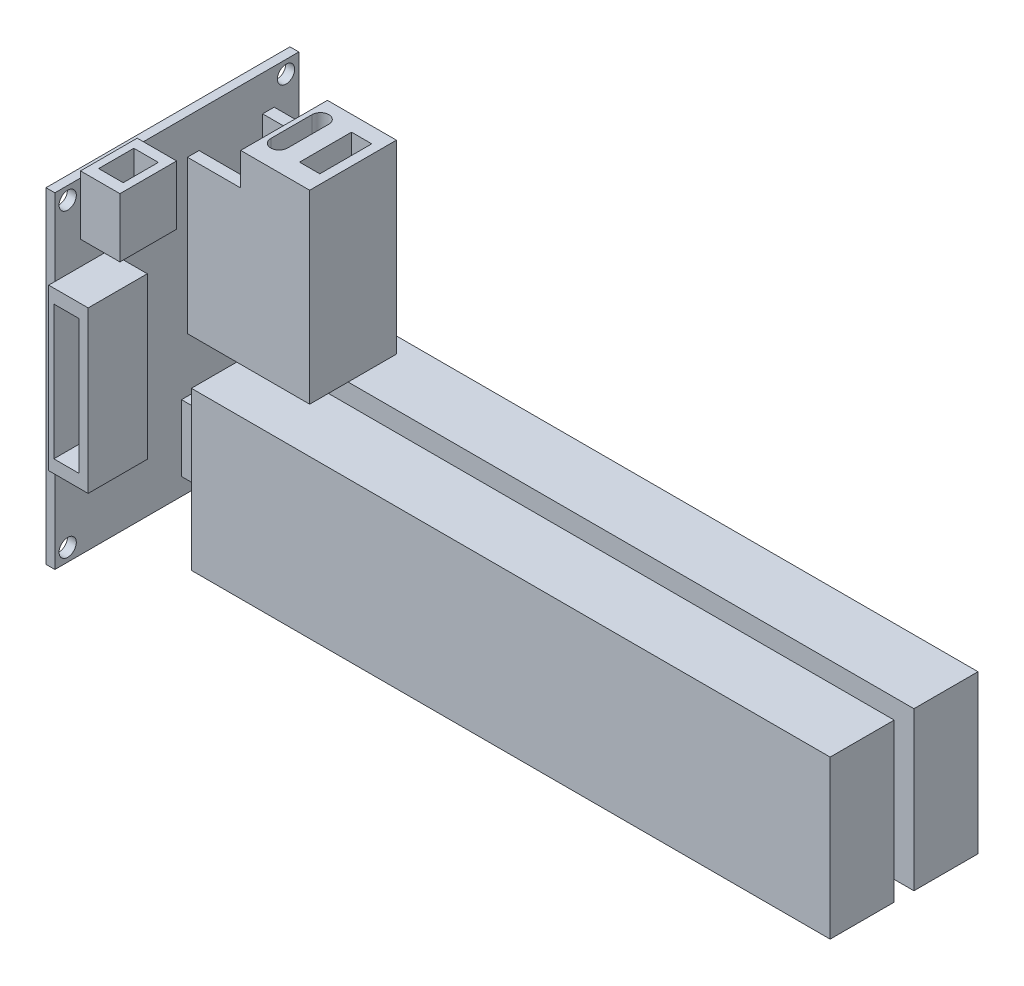
from build123d import *

# Parameters (mm, degrees)
SKETCH2_W               = 129.6
SKETCH2_H               = 32
BOSS_EXTRUDE1_DEPTH     = 30
SKETCH3_W               = 2.4
SKETCH3_H               = 13.5
BOSS_EXTRUDE2_DEPTH     = 8
SKETCH4_W               = 49.5
SKETCH4_H               = 66.2
BOSS_EXTRUDE3_DEPTH     = 1.8
SKETCH5_R               = 1.75
CUT_EXTRUDE1_DEPTH      = 1.8
SKETCH6_W               = 2.35
SKETCH6_H               = 31
BOSS_EXTRUDE4_DEPTH     = 10.8
SKETCH7_W               = 17.6
SKETCH7_H               = 37.6
BOSS_EXTRUDE5_DEPTH     = 14
SKETCH8_W               = 11.5
SKETCH8_H               = 12
SKETCH8_W_2             = 12
SKETCH8_H_2             = 32.6
BOSS_EXTRUDE6_DEPTH     = 8
CUT_EXTRUDE2_DEPTH      = 8
CUT_EXTRUDE2_DEPTH_BACK = 8
SKETCH9_W               = 4.972856148
SKETCH9_H               = 7.139248924
SKETCH9_W_2             = 4.11169422
SKETCH9_H_2             = 10.539835888
SKETCH10_W              = 5.114878679
SKETCH10_H              = 27.206324026
CUT_EXTRUDE3_DEPTH      = 8
CUT_EXTRUDE4_DEPTH      = 166.599411231
CUT_EXTRUDE4_DEPTH_BACK = 129.6
SKETCH11_W              = 4
SKETCH11_H              = 32


with BuildPart() as part:
    # Sketch2 → Boss-Extrude1 (new body)
    with BuildSketch(Plane.XY):
        with Locations((64.8, 16)):
            Rectangle(SKETCH2_W, SKETCH2_H)
    extrude(amount=BOSS_EXTRUDE1_DEPTH)

    # Sketch3 → Boss-Extrude2 (add)
    with BuildSketch(Plane.ZY):
        with Locations((7.2, 16.25)):
            Rectangle(SKETCH3_W, SKETCH3_H)
        with Locations((22.8, 16.25)):
            Rectangle(SKETCH3_W, SKETCH3_H)
    extrude(amount=BOSS_EXTRUDE2_DEPTH)

    # Sketch4 → Boss-Extrude3 (add)
    with BuildSketch(Plane.ZY.offset(8)):
        with Locations((24.95, 39.1)):
            Rectangle(SKETCH4_W, SKETCH4_H)
    extrude(amount=BOSS_EXTRUDE3_DEPTH)

    # Sketch5 → Cut-Extrude1 (cut)
    with BuildSketch(Plane.ZY.offset(9.8)):
        with Locations((2.8, 69.6)):
            Circle(SKETCH5_R)
        with Locations((47.1, 69.6)):
            Circle(SKETCH5_R)
        with Locations((47.1, 8.6)):
            Circle(SKETCH5_R)
        with Locations((2.8, 8.6)):
            Circle(SKETCH5_R)
    extrude(amount=-CUT_EXTRUDE1_DEPTH, mode=Mode.SUBTRACT)

    # Sketch6 → Boss-Extrude4 (add)
    with BuildSketch(Plane(origin=(-8, 0, 0), x_dir=(0, 0, -1), z_dir=(1, 0, 0))):
        with Locations((-6.375, 49.5)):
            Rectangle(SKETCH6_W, SKETCH6_H)
        with Locations((-21.625, 49.5)):
            Rectangle(SKETCH6_W, SKETCH6_H)
    extrude(amount=BOSS_EXTRUDE4_DEPTH)

    # Sketch7 → Boss-Extrude5 (add)
    with BuildSketch(Plane(origin=(2.8, 0, 0), x_dir=(0, 0, -1), z_dir=(1, 0, 0))):
        with Locations((-14, 52.8)):
            Rectangle(SKETCH7_W, SKETCH7_H)
    extrude(amount=BOSS_EXTRUDE5_DEPTH)

    # Sketch8 → Boss-Extrude6 (add)
    with BuildSketch(Plane(origin=(-8, 0, 0), x_dir=(0, 0, -1), z_dir=(1, 0, 0))):
        with Locations((-38.75, 67.45)):
            Rectangle(SKETCH8_W, SKETCH8_H)
        with Locations((-44.95, 40.3)):
            Rectangle(SKETCH8_W_2, SKETCH8_H_2)
    extrude(amount=BOSS_EXTRUDE6_DEPTH)

    # Sketch9 → Cut-Extrude2 (cut, two sides: drawn at the far end of the back side and taken through both)
    with BuildSketch(Plane(origin=(0, 71.6, 0), x_dir=(1, 0, 0), z_dir=(0, 1, 0)).offset(-CUT_EXTRUDE2_DEPTH_BACK)):
        with Locations((-4.081901009, -38.681765119)):
            Rectangle(SKETCH9_W, SKETCH9_H)
        with BuildLine():
            Line((7.144873984, -9.259110814), (7.144873984, -17.632407274))
            ThreePointArc((7.144873984, -17.632407274), (5.446047642, -19.331233616), (3.747221299, -17.632407274))
            Line((3.747221299, -17.632407274), (3.747221299, -9.259110814))
            ThreePointArc((3.747221299, -9.259110814), (5.446047642, -7.560284471), (7.144873984, -9.259110814))
        make_face()
        with Locations((12.887635068, -13.619492602)):
            Rectangle(SKETCH9_W_2, SKETCH9_H_2)
    extrude(amount=CUT_EXTRUDE2_DEPTH + CUT_EXTRUDE2_DEPTH_BACK, mode=Mode.SUBTRACT)

    # Sketch10 → Cut-Extrude3 (cut)
    with BuildSketch(Plane.XY.offset(50.95)):
        with Locations((-4.404776722, 40.202538217)):
            Rectangle(SKETCH10_W, SKETCH10_H)
    extrude(amount=-CUT_EXTRUDE3_DEPTH, mode=Mode.SUBTRACT)

    # Sketch11 → Cut-Extrude4 (cut, two sides: drawn at the far end of the back side and taken through both)
    with BuildSketch(Plane(origin=(129.6, 0, 0), x_dir=(0, 0, -1), z_dir=(1, 0, 0)).offset(-CUT_EXTRUDE4_DEPTH_BACK)):
        with Locations((-15, 16)):
            Rectangle(SKETCH11_W, SKETCH11_H)
    extrude(amount=CUT_EXTRUDE4_DEPTH + CUT_EXTRUDE4_DEPTH_BACK, mode=Mode.SUBTRACT)


solid = part.part
